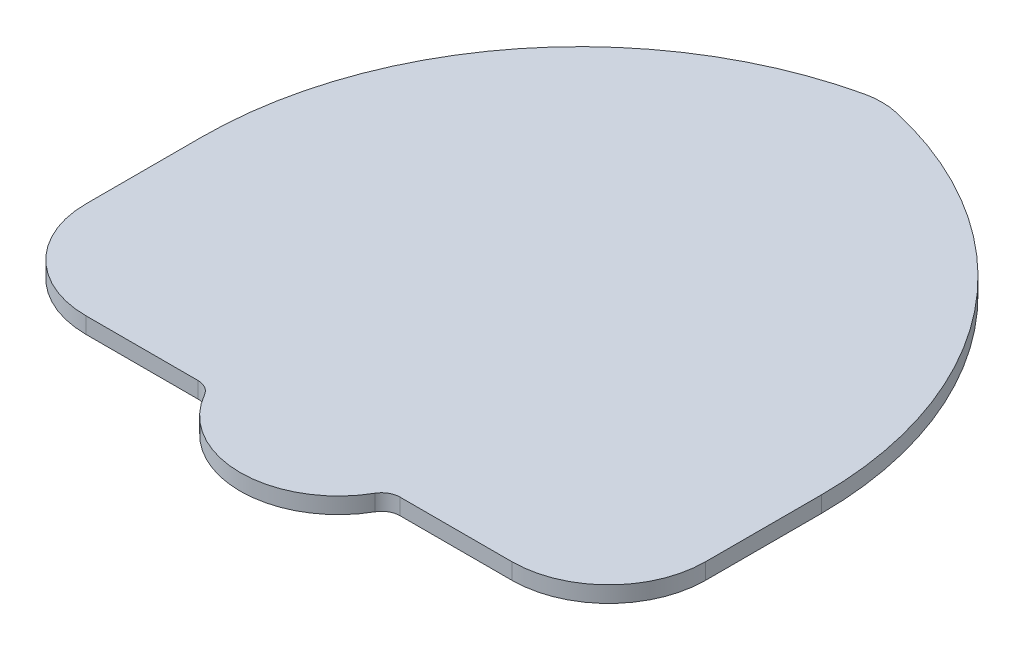
from build123d import *

# Parameters (mm, degrees)
BOSS_EXTRUDE1_DEPTH = 5.588
FILLET1_R           = 25.4
BOSS_EXTRUDE2_DEPTH = 5.588
FILLET2_R           = 6.35
FILLET3_R           = 33.528


with BuildPart() as part:
    # Sketch1 → Boss-Extrude1 (new body)
    with BuildSketch(Plane(origin=(0, 0, 0), x_dir=(1, 0, 0), z_dir=(0, 1, 0))):
        with BuildLine():
            Line((0, 0), (214.63, 0))
            Line((214.63, 0), (214.63, 73.66))
            ThreePointArc((214.63, 73.66), (184.284533276, 157.475694397), (107.315, 202.438))
            ThreePointArc((107.315, 202.438), (30.345466724, 157.475694397), (0, 73.66))
            Line((0, 73.66), (0, 0))
        make_face()
    extrude(amount=BOSS_EXTRUDE1_DEPTH)

    # Fillet1
    fillet1_edges = [part.edges().sort_by_distance(p)[0] for p in [
        (107.315, 2.794, -202.438),
    ]]
    fillet(fillet1_edges, radius=FILLET1_R)

    # Sketch2 → Boss-Extrude2 (add)
    with BuildSketch(Plane(origin=(0, 5.588, 0), x_dir=(1, 0, 0), z_dir=(0, 1, 0))):
        with BuildLine():
            Line((138.43, 0), (76.2, 0))
            ThreePointArc((76.2, 0), (107.315, -20.32), (138.43, 0))
        make_face()
    extrude(amount=-BOSS_EXTRUDE2_DEPTH)

    # Fillet2
    fillet2_edges = [part.edges().sort_by_distance(p)[0] for p in [
        (76.2, 2.794, 0),
        (138.43, 2.794, 0),
    ]]
    fillet(fillet2_edges, radius=FILLET2_R)

    # Fillet3
    fillet3_edges = [part.edges().sort_by_distance(p)[0] for p in [
        (214.63, 2.794, 0),
        (0, 2.794, 0),
    ]]
    fillet(fillet3_edges, radius=FILLET3_R)


solid = part.part
